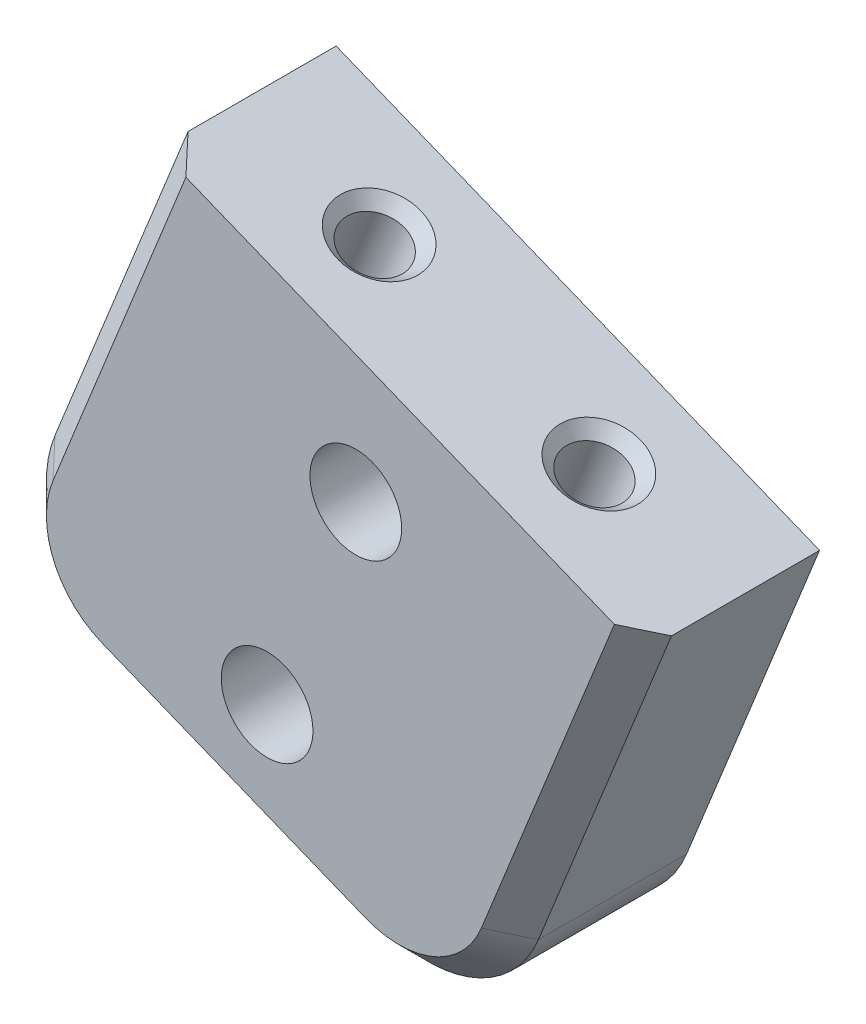
from build123d import *

# Parameters (mm, degrees)
BOSS_EXTRUDE1_DEPTH                 = 9.525
FILLET1_R                           = 6.35
CHAMFER3_SIZE                       = 1.5875
F_1_8_0_126_DOWEL_HOLE1_D           = 3.2004
F_1_8_0_126_DOWEL_HOLE1_DEPTH       = 11.1125
F_1_8_0_126_DOWEL_HOLE1_CSINK_D     = 4.4704
F_1_8_0_126_DOWEL_HOLE1_CSINK_ANGLE = 90
F_1_8_0_126_DOWEL_HOLE1_TIP         = 0.961497163
F_1_16_0_0625_DIAMETER_HOLE1_D      = 1.5875
F_8_CLEARANCE_HOLE1_D               = 4.9149


with BuildPart() as part:
    # Sketch1 → Boss-Extrude1 (new body)
    with BuildSketch(Plane.XY):
        Polygon((822.963473633, 732.863646666), (813.457215496, 709.309643689), (787.547812221, 719.76652764), (797.054070358, 743.320530617), align=None)
    extrude(amount=BOSS_EXTRUDE1_DEPTH)

    # Fillet1
    fillet1_edges = [part.edges().sort_by_distance(p)[0] for p in [
        (813.457215496, 709.309643689, 4.7625),
        (787.547812221, 719.76652764, 4.7625),
    ]]
    fillet(fillet1_edges, radius=FILLET1_R)

    # Chamfer3
    chamfer3_edges = [part.edges().sort_by_distance(p)[0] for p in [
        (800.502513859, 714.538085664, 9.525),
        (819.398626831, 724.03089555, 9.525),
        (812.428593195, 711.730425262, 9.525),
        (789.968593794, 720.795149941, 9.525),
        (793.489223557, 734.4877795, 9.525),
    ]]
    chamfer(chamfer3_edges, length=CHAMFER3_SIZE)

    # 1/8 (0.126) Dowel Hole1
    with Locations(Plane(origin=(369.623280938, 915.829102682, 0), x_dir=(0.9273229518431505, -0.3742621313797403, 0), z_dir=(0.3742621313797403, 0.9273229518431505, 0))):
        with Locations((481.249807216, -4.7625), (468.549807216, -4.7625)):
            CounterSinkHole(F_1_8_0_126_DOWEL_HOLE1_D / 2, F_1_8_0_126_DOWEL_HOLE1_CSINK_D / 2, depth=F_1_8_0_126_DOWEL_HOLE1_DEPTH, counter_sink_angle=F_1_8_0_126_DOWEL_HOLE1_CSINK_ANGLE)
            with Locations((0, 0, -(F_1_8_0_126_DOWEL_HOLE1_DEPTH + F_1_8_0_126_DOWEL_HOLE1_TIP / 2))):  # 118° drill point
                Cone(0, F_1_8_0_126_DOWEL_HOLE1_D / 2, F_1_8_0_126_DOWEL_HOLE1_TIP, mode=Mode.SUBTRACT)

    # 1/16 (0.0625) Diameter Hole1 (through all)
    with Locations(Plane(origin=(369.623280938, 915.829102682, 0), x_dir=(0.9273229518431505, -0.3742621313797403, 0), z_dir=(0.3742621313797403, 0.9273229518431505, 0))):
        with Locations((468.549807216, -4.7625), (481.249807216, -4.7625)):
            Hole(F_1_16_0_0625_DIAMETER_HOLE1_D / 2)

    # #8 Clearance Hole1 (through all)
    with Locations(Plane.XY.offset(9.525)):
        with Locations((802.879078393, 720.426586409), (807.632207461, 732.203587897)):
            Hole(F_8_CLEARANCE_HOLE1_D / 2)


solid = part.part
